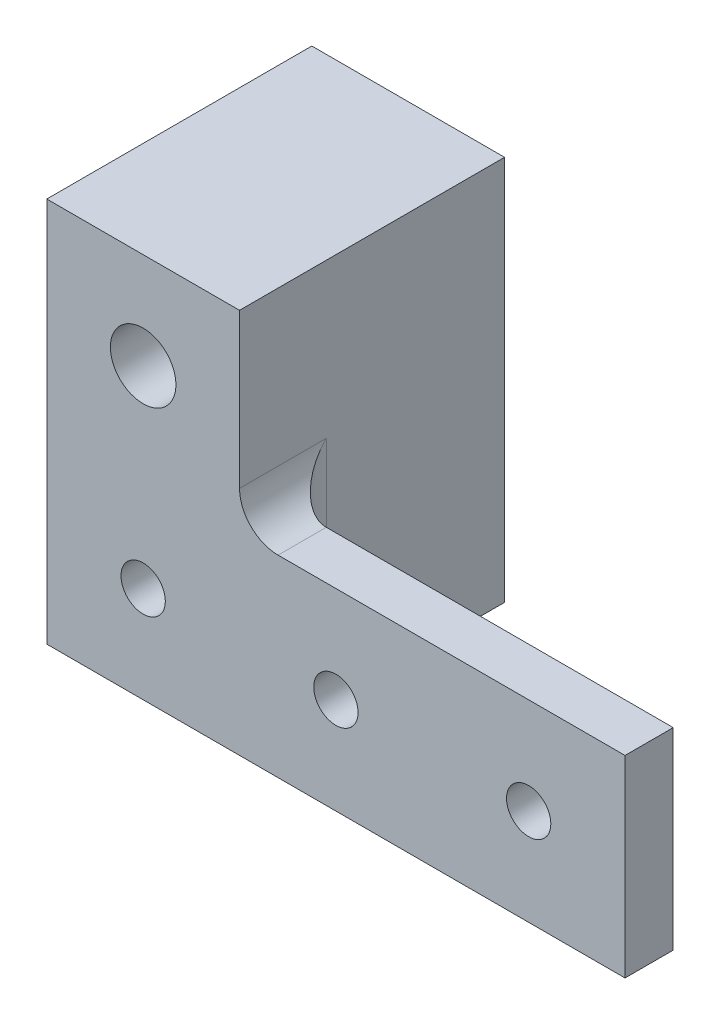
from build123d import *

# Parameters (mm, degrees)
BOSS_EXTRUDE1_DEPTH = 34.925
SKETCH2_R           = 2.921
CUT_EXTRUDE1_DEPTH  = 99.014466407
SKETCH4_W           = 50.8
SKETCH4_H           = 28.575
CUT_EXTRUDE3_DEPTH  = 99.014466407
FILLET1_R           = 5.08
SKETCH5_R           = 4.318
CUT_EXTRUDE4_DEPTH  = 12.7


with BuildPart() as part:
    # Sketch1 → Boss-Extrude1 (new body)
    with BuildSketch(Plane.XY):
        Polygon((0, 0), (0, 50.8), (25.4, 50.8), (25.4, 25.4), (76.2, 25.4), (76.2, 0), align=None)
    extrude(amount=BOSS_EXTRUDE1_DEPTH)

    # Sketch2 → Cut-Extrude1 (cut, through all)
    with BuildSketch(Plane.XY.offset(34.925)):
        with Locations((12.7, 38.1)):
            Circle(SKETCH2_R)
        with Locations((12.7, 12.7)):
            Circle(SKETCH2_R)
        with Locations((38.1, 12.7)):
            Circle(SKETCH2_R)
        with Locations((63.5, 12.7)):
            Circle(SKETCH2_R)
    extrude(amount=-CUT_EXTRUDE1_DEPTH, mode=Mode.SUBTRACT)

    # Sketch4 → Cut-Extrude3 (cut, through all)
    with BuildSketch(Plane.XZ):
        with Locations((50.8, 14.2875)):
            Rectangle(SKETCH4_W, SKETCH4_H)
    extrude(amount=-CUT_EXTRUDE3_DEPTH, mode=Mode.SUBTRACT)

    # Fillet1
    fillet1_edges = [part.edges().sort_by_distance(p)[0] for p in [
        (25.4, 25.4, 31.75),
        (25.4, 12.7, 28.575),
    ]]
    fillet(fillet1_edges, radius=FILLET1_R)

    # Sketch5 → Cut-Extrude4 (cut)
    with BuildSketch(Plane.XY.offset(34.925)):
        with Locations((12.7, 38.1)):
            Circle(SKETCH5_R)
    extrude(amount=-CUT_EXTRUDE4_DEPTH, mode=Mode.SUBTRACT)


solid = part.part
